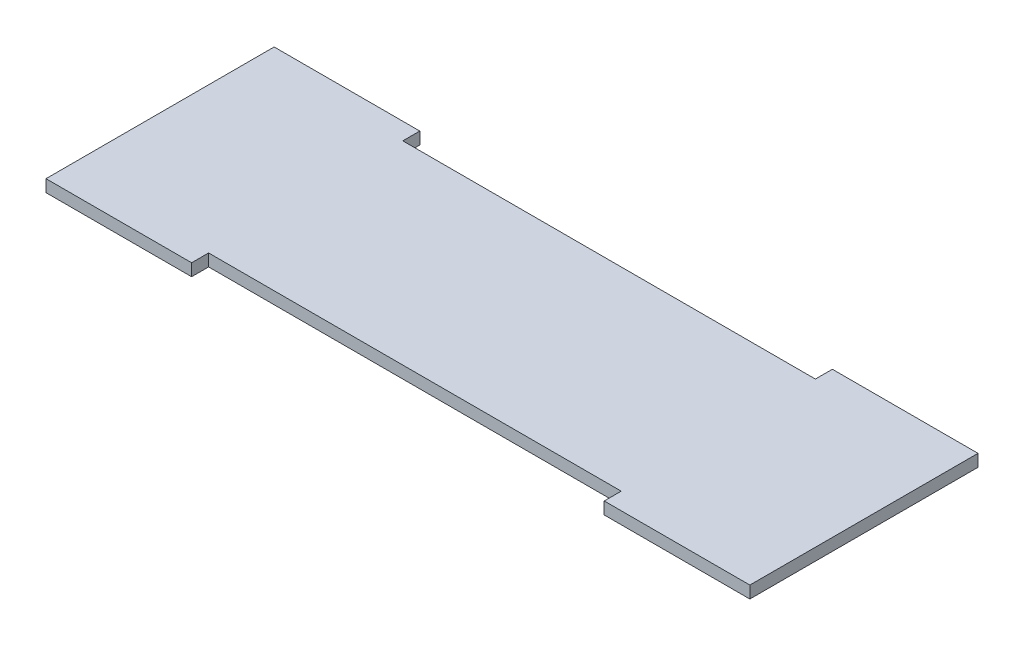
from build123d import *

# Parameters (mm, degrees)
BOSS_EXTRUDE1_DEPTH = 5


with BuildPart() as part:
    # Sketch1 → Boss-Extrude1 (new body)
    with BuildSketch(Plane(origin=(0, 0, 0), x_dir=(1, 0, 0), z_dir=(0, 1, 0))):
        Polygon((-145, 47), (-85, 47), (-85, 40), (85, 40), (85, 47), (145, 47), (145, -47), (85, -47), (85, -40), (-85, -40), (-85, -47), (-145, -47), align=None)
    extrude(amount=BOSS_EXTRUDE1_DEPTH)


solid = part.part
